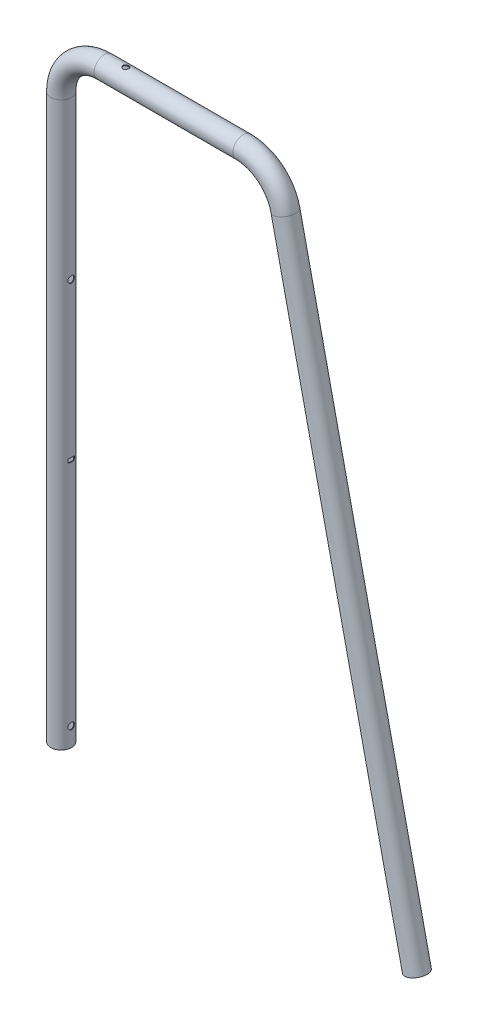
from build123d import *

# Parameters (mm, degrees)
SKETCH2_R                      = 12.7
SKETCH2_R_2                    = 11.9
SKETCH5_R                      = 4
CUT_EXTRUDE1_DEPTH             = 879.773548308
CUT_EXTRUDE1_DIRECTION_2_REACH = 880.774
CUT_EXTRUDE2_REACH             = 880.774
CUT_EXTRUDE2_DIRECTION_2_REACH = 880.774
CUT_EXTRUDE3_REACH             = 903.028
CUT_EXTRUDE3_END_RADIUS        = 12.7
SKETCH9_R                      = 5.2
CUT_EXTRUDE4_DEPTH             = 50
CUT_EXTRUDE4_DEPTH_BACK        = 50
SKETCH11_R                     = 3.5


with BuildPart() as part:
    # Sweep1: sweep along a path in Sketch1
    with BuildLine(Plane.XY) as sweep1_path:
        Line((-138, -743), (-138, -53))
        ThreePointArc((-138, -53), (-122.476659403, -15.523340597), (-85, 0))
        Line((-85, 0), (85, 0))
        ThreePointArc((85, 0), (118.173944026, -11.666122396), (136.743688377, -41.528700461))
        Line((136.743688377, -41.528700461), (297.930349424, -768.594743121))
    # Sketch2 → Sweep1 (sweep)
    with BuildSketch(Plane(origin=(-138, -743, 0), x_dir=(-1, 0, 0), z_dir=(0, -1, 0))):
        Circle(SKETCH2_R)
        Circle(SKETCH2_R_2, mode=Mode.SUBTRACT)
    sweep(path=sweep1_path.line)

    # Sketch5 → Cut-Extrude1 (cut)
    with BuildSketch(Plane(origin=(-138, -743, 0), x_dir=(0, 0, 1), z_dir=(-1, 0, 0))):
        with Locations((0, 23)):
            Circle(SKETCH5_R)
        with Locations(Location((0, 497, 0), (0, 0, 180))):
            Circle(SKETCH5_R)
    extrude(amount=CUT_EXTRUDE1_DEPTH, mode=Mode.SUBTRACT)

    # Sketch5 → Cut-Extrude1 direction 2 (cut, up to next)
    with BuildSketch(Plane(origin=(-138, -743, 0), x_dir=(0, 0, 1), z_dir=(-1, 0, 0)), mode=Mode.PRIVATE) as cut_extrude1_direction_2_sk1:
        with Locations((0, 23)):
            Circle(SKETCH5_R)
    cut_extrude1_direction_2_tool1 = extrude(cut_extrude1_direction_2_sk1.sketch, amount=-CUT_EXTRUDE1_DIRECTION_2_REACH, mode=Mode.PRIVATE) & part.part
    # Sketch5 → Cut-Extrude1 direction 2 (cut, up to next)
    with BuildSketch(Plane(origin=(-138, -743, 0), x_dir=(0, 0, 1), z_dir=(-1, 0, 0)), mode=Mode.PRIVATE) as cut_extrude1_direction_2_sk2:
        with Locations(Location((0, 497, 0), (0, 0, 180))):
            Circle(SKETCH5_R)
    cut_extrude1_direction_2_tool2 = extrude(cut_extrude1_direction_2_sk2.sketch, amount=-CUT_EXTRUDE1_DIRECTION_2_REACH, mode=Mode.PRIVATE) & part.part
    add(cut_extrude1_direction_2_tool1.solids().sort_by_distance((-138, -720, 0))[0], mode=Mode.SUBTRACT)
    add(cut_extrude1_direction_2_tool2.solids().sort_by_distance((-138, -246, 0))[0], mode=Mode.SUBTRACT)

    # Sketch6 → Cut-Extrude2 (cut, up to next)
    with BuildSketch(Plane(origin=(-138, -743, 0), x_dir=(0, 0, 1), z_dir=(-1, 0, 0)), mode=Mode.PRIVATE) as cut_extrude2_sk1:
        with BuildLine():
            Line((-2.5, 303.126535535), (2.5, 303.126535535))
            ThreePointArc((2.5, 303.126535535), (3.560660172, 303.565875363), (4, 304.626535535))
            Line((4, 304.626535535), (4, 306.626535535))
            ThreePointArc((4, 306.626535535), (3.560660172, 307.687195707), (2.5, 308.126535535))
            Line((2.5, 308.126535535), (-2.5, 308.126535535))
            ThreePointArc((-2.5, 308.126535535), (-3.560660172, 307.687195707), (-4, 306.626535535))
            Line((-4, 306.626535535), (-4, 304.626535535))
            ThreePointArc((-4, 304.626535535), (-3.560660172, 303.565875363), (-2.5, 303.126535535))
        make_face()
    cut_extrude2_tool1 = extrude(cut_extrude2_sk1.sketch, amount=-CUT_EXTRUDE2_REACH, mode=Mode.PRIVATE) & part.part
    add(cut_extrude2_tool1.solids().sort_by_distance((-138, -437.373464, 0))[0], mode=Mode.SUBTRACT)

    # Sketch6 → Cut-Extrude2 direction 2 (cut, up to next)
    with BuildSketch(Plane(origin=(-138, -743, 0), x_dir=(0, 0, 1), z_dir=(-1, 0, 0)), mode=Mode.PRIVATE) as cut_extrude2_direction_2_sk1:
        with BuildLine():
            Line((-2.5, 303.126535535), (2.5, 303.126535535))
            ThreePointArc((2.5, 303.126535535), (3.560660172, 303.565875363), (4, 304.626535535))
            Line((4, 304.626535535), (4, 306.626535535))
            ThreePointArc((4, 306.626535535), (3.560660172, 307.687195707), (2.5, 308.126535535))
            Line((2.5, 308.126535535), (-2.5, 308.126535535))
            ThreePointArc((-2.5, 308.126535535), (-3.560660172, 307.687195707), (-4, 306.626535535))
            Line((-4, 306.626535535), (-4, 304.626535535))
            ThreePointArc((-4, 304.626535535), (-3.560660172, 303.565875363), (-2.5, 303.126535535))
        make_face()
    cut_extrude2_direction_2_tool1 = extrude(cut_extrude2_direction_2_sk1.sketch, amount=CUT_EXTRUDE2_DIRECTION_2_REACH, mode=Mode.PRIVATE) & part.part
    add(cut_extrude2_direction_2_tool1.solids().sort_by_distance((-138, -437.373464, 0))[0], mode=Mode.SUBTRACT)

    # Cut-Extrude3: up to this cylinder (the profile starts inside it)
    cut_extrude3_end = Plane(origin=(292.952238298, -746.139934934, 0), z_dir=(-0.2164396139381038, 0.9762960071199331, 0)) * Cylinder(CUT_EXTRUDE3_END_RADIUS, 1832.456, mode=Mode.PRIVATE)
    # Sketch9 → Cut-Extrude3 (cut, up to the surface)
    with BuildSketch(Plane(origin=(297.930349424, -768.594743121, 0), x_dir=(0, 0, -1), z_dir=(0.9762960071199321, 0.21643961393810845, 0)), mode=Mode.PRIVATE) as cut_extrude3_sk1:
        with Locations(Location((0, 23, 0), (0, 0, 90))):
            Circle(SKETCH9_R)
    cut_extrude3_tool1 = extrude(cut_extrude3_sk1.sketch, amount=-CUT_EXTRUDE3_REACH, mode=Mode.PRIVATE) & cut_extrude3_end
    add(cut_extrude3_tool1.solids().sort_by_distance((292.952238, -746.139935, 0))[0], mode=Mode.SUBTRACT)

    # Sketch11 → Cut-Extrude4 (cut, two sides: drawn at the far end of the back side and taken through both)
    with BuildSketch(Plane(origin=(0, 0, 0), x_dir=(1, 0, 0), z_dir=(0, 1, 0)).offset(-CUT_EXTRUDE4_DEPTH_BACK)):
        with Locations(Location((-58.7, 0, 0), (0, 0, 90))):
            Circle(SKETCH11_R)
    extrude(amount=CUT_EXTRUDE4_DEPTH + CUT_EXTRUDE4_DEPTH_BACK, mode=Mode.SUBTRACT)


solid = part.part
